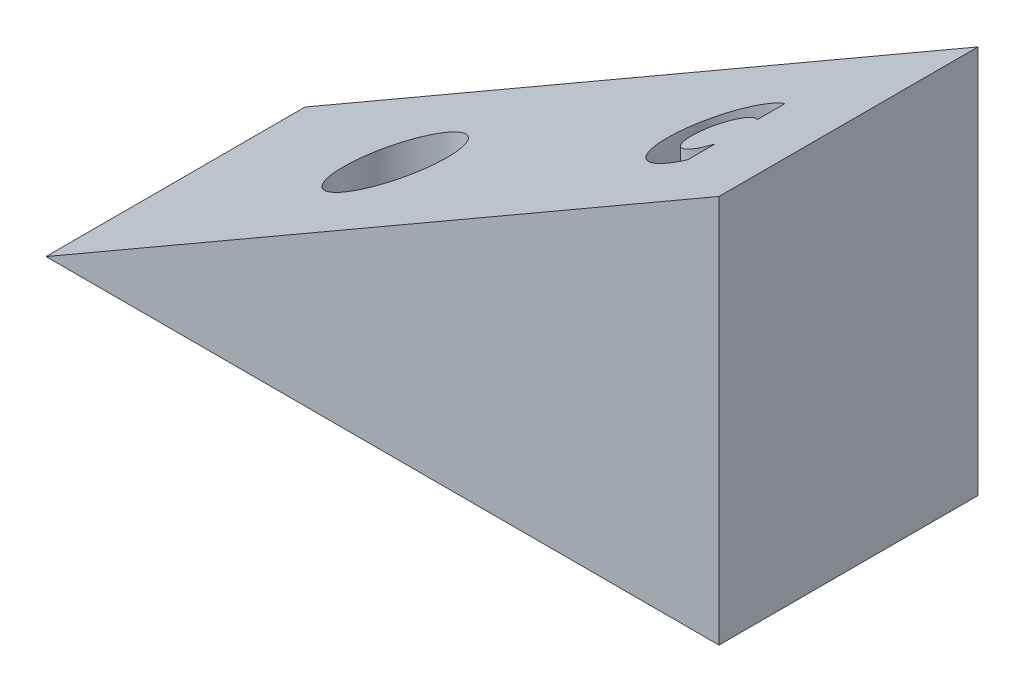
from build123d import *

# Parameters (mm, degrees)
EXTRUDE_1_DEPTH     = 20
SKETCH_2_R          = 2.1
CUT_EXTRUDE_1_DEPTH = 20
SKETCH_3_R          = 4
SKETCH_3_R_2        = 2.1
CUT_EXTRUDE_2_DEPTH = 20


with BuildPart() as part:
    # ｽｹｯﾁ1 → ﾎﾞｽ - 押し出し1 (new body)
    with BuildSketch(Plane.XY):
        Polygon((0, 0), (51.961524227, 0), (51.961524227, 30), align=None)
    extrude(amount=EXTRUDE_1_DEPTH)

    # ｽｹｯﾁ2 → ｶｯﾄ - 押し出し1 (cut)
    with BuildSketch(Plane(origin=(0, 0, 0), x_dir=(-1, 0, 0), z_dir=(0, -1, 0))):
        with Locations(Location((-16.961524227, -10, 0), (0, 0, 180))):
            Circle(SKETCH_2_R)
        with Locations(Location((-41.961524227, -10, 0), (0, 0, 180))):
            Circle(SKETCH_2_R)
    extrude(amount=-CUT_EXTRUDE_1_DEPTH, mode=Mode.SUBTRACT)

    # ｽｹｯﾁ3 → ｶｯﾄ - 押し出し2 (cut)
    # profile 1 of 2: a face of its own
    with BuildSketch(Plane(origin=(0, 5, 0), x_dir=(-1, 0, 0), z_dir=(0, -1, 0))):
        with Locations(Location((-16.961524227, -10, 0), (0, 0, 180))):
            Circle(SKETCH_3_R)
        with Locations(Location((-16.961524227, -10, 0), (0, 0, 180))):
            Circle(SKETCH_3_R_2, mode=Mode.SUBTRACT)
    # profile 2 of 2: a face of its own
    with BuildSketch(Plane(origin=(0, 5, 0), x_dir=(-1, 0, 0), z_dir=(0, -1, 0))):
        with Locations(Location((-41.961524227, -10, 0), (0, 0, 180))):
            Circle(SKETCH_3_R)
        with Locations(Location((-41.961524227, -10, 0), (0, 0, 180))):
            Circle(SKETCH_3_R_2, mode=Mode.SUBTRACT)
    extrude(amount=-CUT_EXTRUDE_2_DEPTH, mode=Mode.SUBTRACT)


solid = part.part
